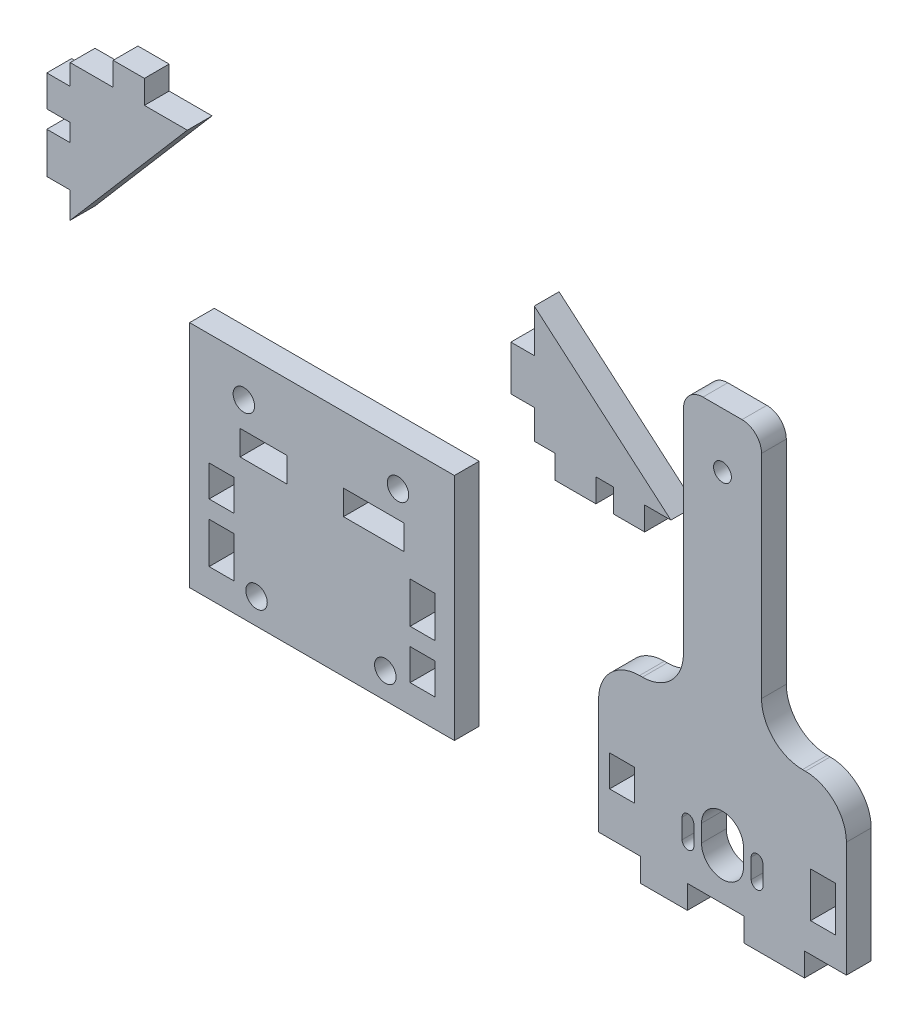
from build123d import *

# Parameters (mm, degrees)
BOSS_EXTRUDE1_DEPTH   = 6.35
MODEL_R               = 2.285
MODEL_W               = 6.349999458
MODEL_H               = 11.499997586
MODEL_H_2             = 7.999997586
BOSS_EXTRUDE1_2_DEPTH = 6.35
MODEL_R_2             = 2.2
MODEL_W_2             = 6.35
MODEL_H_3             = 8
MODEL_H_4             = 10.5
MODEL_W_3             = 12
MODEL_H_5             = 6.35
MODEL_W_4             = 15.5
BOSS_EXTRUDE1_3_DEPTH = 6.35
BOSS_EXTRUDE1_4_DEPTH = 6.35
BOSS_EXTRUDE2_DEPTH   = 6.35
CUT_EXTRUDE2_DEPTH    = 10
SKETCH5_R             = 2.75
CUT_EXTRUDE3_DEPTH    = 10


with BuildPart() as part:
    # Model → Boss-Extrude1 (new body)
    with BuildSketch(Plane.XY):
        Polygon((46.063366814, 150.822944758), (46.063366814, 142.822944378), (52.063366866, 142.822944378), (52.063366866, 138.322944162), (46.063366814, 138.322944162), (46.063366814, 127.822944713), (52.063366866, 127.822944713), (52.063366866, 121.112944377), (82.063366196, 156.112944526), (71.063366255, 156.112944526), (71.063366255, 162.112944578), (63.063366807, 162.112944578), (63.063366807, 156.112944526), (52.063366866, 156.112944526), (52.063366866, 150.822944758), align=None)
    extrude(amount=BOSS_EXTRUDE1_DEPTH)


with BuildPart() as body_2:
    # Model → Boss-Extrude1 2 (new body)
    with BuildSketch(Plane.XY):
        with BuildLine():
            Line((198.186632456, 47.05000008), (210.18663256, 47.05000008))
            Line((210.18663256, 47.05000008), (210.18663256, 53.050001064))
            Line((210.18663256, 53.050001064), (224.686631785, 53.050001064))
            Line((224.686631785, 53.050001064), (224.686631785, 47.05000008))
            Line((224.686631785, 47.05000008), (240.186631889, 47.05000008))
            Line((240.186631889, 47.05000008), (240.186631889, 53.050001064))
            Line((240.186631889, 53.050001064), (250.936633186, 53.050001064))
            Line((250.936633186, 53.050001064), (250.936633186, 82.54999938))
            ThreePointArc((250.936633186, 82.54999938), (247.861254091, 89.974621076), (240.436632396, 93.05000017))
            Line((240.436632396, 93.05000017), (239.686632739, 93.05000017))
            ThreePointArc((239.686632739, 93.05000017), (232.262011141, 96.125378704), (229.186631949, 103.550000028))
            Line((229.186631949, 103.550000028), (229.186631949, 157.949999818))
            ThreePointArc((229.186631949, 157.949999818), (227.722165591, 161.485533076), (224.186632061, 162.949998775))
            Line((224.186632061, 162.949998775), (214.186632284, 162.949998775))
            ThreePointArc((214.186632284, 162.949998775), (210.651098754, 161.485533076), (209.186632396, 157.949999818))
            Line((209.186632396, 157.949999818), (209.186632396, 103.550000028))
            ThreePointArc((209.186632396, 103.550000028), (206.111253204, 96.125378704), (198.686631606, 93.05000017))
            Line((198.686631606, 93.05000017), (197.936631949, 93.05000017))
            ThreePointArc((197.936631949, 93.05000017), (190.512010254, 89.974621076), (187.436631159, 82.54999938))
            Line((187.436631159, 82.54999938), (187.436631159, 53.050001064))
            Line((187.436631159, 53.050001064), (198.186632456, 53.050001064))
            Line((198.186632456, 53.050001064), (198.186632456, 47.05000008))
        make_face()
        with Locations((219.186632172, 148.80999992)):
            Circle(MODEL_R, mode=Mode.SUBTRACT)
        with Locations((244.936632202, 66.299999797)):
            Rectangle(MODEL_W, MODEL_H, mode=Mode.SUBTRACT)
        with Locations((193.436632143, 68.049999797)):
            Rectangle(MODEL_W, MODEL_H_2, mode=Mode.SUBTRACT)
        with BuildLine():
            Line((208.836632059, 67.049999633), (208.836632059, 62.050000676))
            ThreePointArc((208.836632059, 62.050000676), (210.336632072, 60.550000663), (211.836632085, 62.050000676))
            Line((211.836632085, 62.050000676), (211.836632085, 67.049999633))
            ThreePointArc((211.836632085, 67.049999633), (210.336632072, 68.549999646), (208.836632059, 67.049999633))
        make_face(mode=Mode.SUBTRACT)
        with BuildLine():
            Line((212.811632292, 68.200000474), (212.811632292, 63.800000498))
            ThreePointArc((212.811632292, 63.800000498), (219.186632172, 57.425000617), (225.561632053, 63.800000498))
            Line((225.561632053, 63.800000498), (225.561632053, 68.200000474))
            ThreePointArc((225.561632053, 68.200000474), (219.186632172, 74.575000355), (212.811632292, 68.200000474))
        make_face(mode=Mode.SUBTRACT)
        with BuildLine():
            Line((226.53663226, 67.049999633), (226.53663226, 62.050000676))
            ThreePointArc((226.53663226, 62.050000676), (228.036632273, 60.550000663), (229.536632286, 62.050000676))
            Line((229.536632286, 62.050000676), (229.536632286, 67.049999633))
            ThreePointArc((229.536632286, 67.049999633), (228.036632273, 68.549999646), (226.53663226, 67.049999633))
        make_face(mode=Mode.SUBTRACT)
    extrude(amount=BOSS_EXTRUDE1_2_DEPTH)

    # Sketch2 → Boss-Extrude2 (add)
    with BuildSketch(Plane.XY.offset(6.35)):
        with BuildLine():
            Line((226.141476956, 68.200000474), (226.141476956, 63.800000498))
            ThreePointArc((226.141476956, 63.800000498), (219.186632172, 56.845155714), (212.231787389, 63.800000498))
            Line((212.231787389, 63.800000498), (212.231787389, 68.200000474))
            ThreePointArc((212.231787389, 68.200000474), (219.186632172, 75.154845258), (226.141476956, 68.200000474))
        make_face()
        with BuildLine():
            Line((224.561632053, 68.200000474), (224.561632053, 63.800000498))
            ThreePointArc((224.561632053, 63.800000498), (219.186632172, 58.425000617), (213.811632292, 63.800000498))
            Line((213.811632292, 63.800000498), (213.811632292, 68.200000474))
            ThreePointArc((213.811632292, 68.200000474), (219.186632172, 73.575000355), (224.561632053, 68.200000474))
        make_face(mode=Mode.SUBTRACT)
    extrude(amount=-BOSS_EXTRUDE2_DEPTH)


with BuildPart() as body_3:
    # Model → Boss-Extrude1 3 (new body)
    with BuildSketch(Plane.XY):
        with BuildLine():
            Line((63.236644346, 54.888498462), (169.911430495, 54.888498462))
            ThreePointArc((169.911430495, 54.888498462), (116.57403742, 157.038498462), (63.236644346, 54.888498462))
        make_face()
        with Locations((78.57403742, 66.138498462)):
            Circle(MODEL_R_2, mode=Mode.SUBTRACT)
        with Locations((154.57403742, 66.138498462)):
            Circle(MODEL_R_2, mode=Mode.SUBTRACT)
        with Locations((83.57403742, 117.888498462)):
            Circle(MODEL_R_2, mode=Mode.SUBTRACT)
        with Locations((149.57403742, 117.888498462)):
            Circle(MODEL_R_2, mode=Mode.SUBTRACT)
        with BuildLine():
            Line((71.600291376, 124.508498462), (71.600291376, 132.508498462))
            Line((71.600291376, 132.508498462), (83.600291376, 132.508498462))
            ThreePointArc((83.600291376, 132.508498462), (85.721611719, 131.629818805), (86.600291376, 129.508498462))
            Line((86.600291376, 129.508498462), (86.600291376, 124.508498462))
            Line((86.600291376, 124.508498462), (71.600291376, 124.508498462))
        make_face(mode=Mode.SUBTRACT)
        with Locations((90.82403742, 81.068498462)):
            Rectangle(MODEL_W_2, MODEL_H_3, mode=Mode.SUBTRACT)
        with Locations((90.82403742, 67.318498462)):
            Rectangle(MODEL_W_2, MODEL_H_4, mode=Mode.SUBTRACT)
        with Locations((101.57403742, 93.528498462)):
            Rectangle(MODEL_W_3, MODEL_H_5, mode=Mode.SUBTRACT)
        with Locations((142.32403742, 66.068498462)):
            Rectangle(MODEL_W_2, MODEL_H_3, mode=Mode.SUBTRACT)
        with Locations((142.32403742, 79.818498462)):
            Rectangle(MODEL_W_2, MODEL_H_4, mode=Mode.SUBTRACT)
        with Locations((129.82403742, 93.528498462)):
            Rectangle(MODEL_W_4, MODEL_H_5, mode=Mode.SUBTRACT)
        with BuildLine():
            Line((129.62403742, 124.258498462), (129.62403742, 131.258498462))
            ThreePointArc((129.62403742, 131.258498462), (130.209823858, 132.672712024), (131.62403742, 133.258498462))
            Line((131.62403742, 133.258498462), (140.62403742, 133.258498462))
            Line((140.62403742, 133.258498462), (140.62403742, 124.258498462))
            Line((140.62403742, 124.258498462), (129.62403742, 124.258498462))
        make_face(mode=Mode.SUBTRACT)
    extrude(amount=BOSS_EXTRUDE1_3_DEPTH)

    # Sketch4 → Cut-Extrude2 (cut)
    with BuildSketch(Plane.XY.offset(6.35)):
        Polygon((82.64903742, 54.888498462), (82.64903742, 113.703498462), (150.49903742, 113.703498462), (150.49903742, 54.888498462), (177.464223164, 45.724379929), (187.548511436, 101.148049377), (181.20637086, 118.022673409), (161.89688875, 140.774931398), (153.514477912, 163.078131664), (94.687916137, 166.82027936), (55.320522378, 121.465449289), (31.670148942, 45.724379929), align=None)
    extrude(amount=-CUT_EXTRUDE2_DEPTH, mode=Mode.SUBTRACT)

    # Sketch5 → Cut-Extrude3 (cut)
    with BuildSketch(Plane.XY.offset(6.35)):
        with Locations((99.798626622, 61.5061567)):
            Circle(SKETCH5_R)
        with Locations((132.798626622, 61.5061567)):
            Circle(SKETCH5_R)
        with Locations((96.548626622, 103.5061567)):
            Circle(SKETCH5_R)
        with Locations((136.048626622, 103.5061567)):
            Circle(SKETCH5_R)
    extrude(amount=-CUT_EXTRUDE3_DEPTH, mode=Mode.SUBTRACT)


with BuildPart() as body_4:
    # Model → Boss-Extrude1 4 (new body)
    with BuildSketch(Plane.XY):
        Polygon((164.964183141, 139.039941551), (164.964183141, 150.539941), (170.964183193, 150.539941), (170.964183193, 161.53994094), (205.964183342, 131.539941611), (199.254183006, 131.539941611), (199.254183006, 125.539941558), (191.254183557, 125.539941558), (191.254183557, 131.539941611), (186.754183341, 131.539941611), (186.754183341, 125.539941558), (176.254182961, 125.539941558), (176.254182961, 131.539941611), (170.964183193, 131.539941611), (170.964183193, 139.039941551), align=None)
    extrude(amount=BOSS_EXTRUDE1_4_DEPTH)


solid = Compound([part.part, body_2.part, body_3.part, body_4.part])
